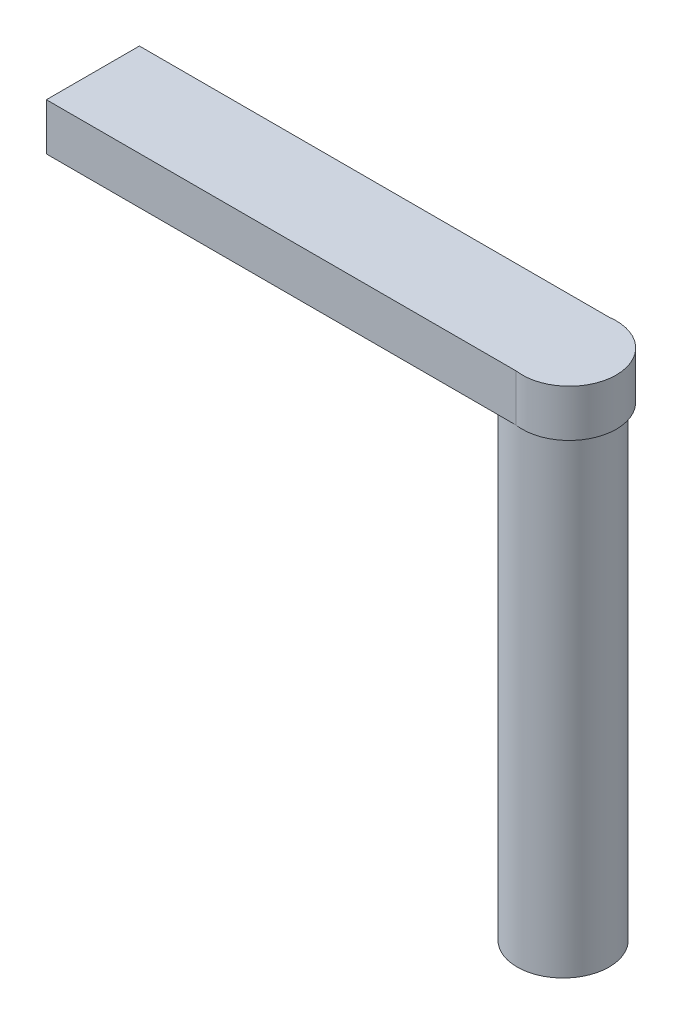
from build123d import *

# Parameters (mm, degrees)
SKETCH1_R           = 4.9
BOSS_EXTRUDE1_DEPTH = 50
BOSS_EXTRUDE2_DEPTH = 5


with BuildPart() as part:
    # Sketch1 → Boss-Extrude1 (new body)
    with BuildSketch(Plane(origin=(0, 0, 0), x_dir=(1, 0, 0), z_dir=(0, 1, 0))):
        with Locations(Location((0, 0, 0), (0, 0, 270))):
            Circle(SKETCH1_R)
    extrude(amount=BOSS_EXTRUDE1_DEPTH)

    # Sketch2 → Boss-Extrude2 (add)
    with BuildSketch(Plane(origin=(0, 50, 0), x_dir=(1, 0, 0), z_dir=(0, 1, 0))):
        with BuildLine():
            Line((0, 4.9), (-50, 4.9))
            Line((-50, 4.9), (-50, -5))
            Line((-50, -5), (0, -5))
            ThreePointArc((0, -5), (5.705336799, -0.05), (0, 4.9))
        make_face()
    extrude(amount=BOSS_EXTRUDE2_DEPTH)


solid = part.part
